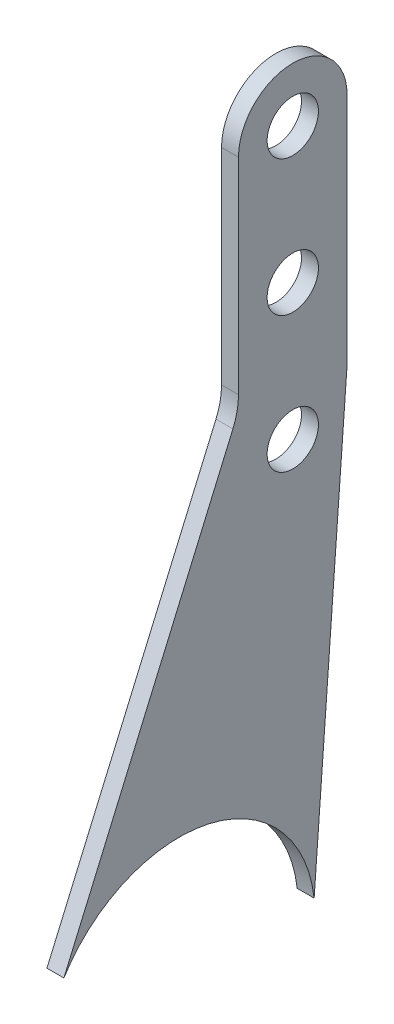
from build123d import *

# Parameters (mm, degrees)
BOSS_EXTRUDE1_DEPTH  = 0.79375
M4_CLEARANCE_HOLE1_D = 4.8


with BuildPart() as part:
    # Sketch1 → Boss-Extrude1 (new, symmetric)
    with BuildSketch(Plane(origin=(0, 0, 0), x_dir=(0, 0, -1), z_dir=(1, 0, 0))):
        with BuildLine():
            Line((-5.08, 12.7), (-5.08, -6.538207725))
            ThreePointArc((-5.08, -6.538207725), (-5.211700121, -7.824771606), (-5.601337517, -9.057968362))
            Line((-5.601337517, -9.057968362), (-21.415741229, -45.63954689))
            ThreePointArc((-21.415741229, -45.63954689), (-7.844956242, -39.930269315), (2.000109042, -50.877266399))
            Line((2.000109042, -50.877266399), (5.062707082, -9.46401976))
            ThreePointArc((5.062707082, -9.46401976), (5.075675298, -9.230020736), (5.08, -8.995702545))
            Line((5.08, -8.995702545), (5.08, 12.7))
            ThreePointArc((5.08, 12.7), (0, 17.78), (-5.08, 12.7))
        make_face()
    extrude(amount=BOSS_EXTRUDE1_DEPTH, both=True)

    # M4 Clearance Hole1 (through all)
    with Locations(Plane(origin=(0.79375, 0, 0), x_dir=(0, 0, -1), z_dir=(1, 0, 0))):
        with Locations((0, 0), (0, 12.7), (0, -12.7)):
            Hole(M4_CLEARANCE_HOLE1_D / 2)


solid = part.part
